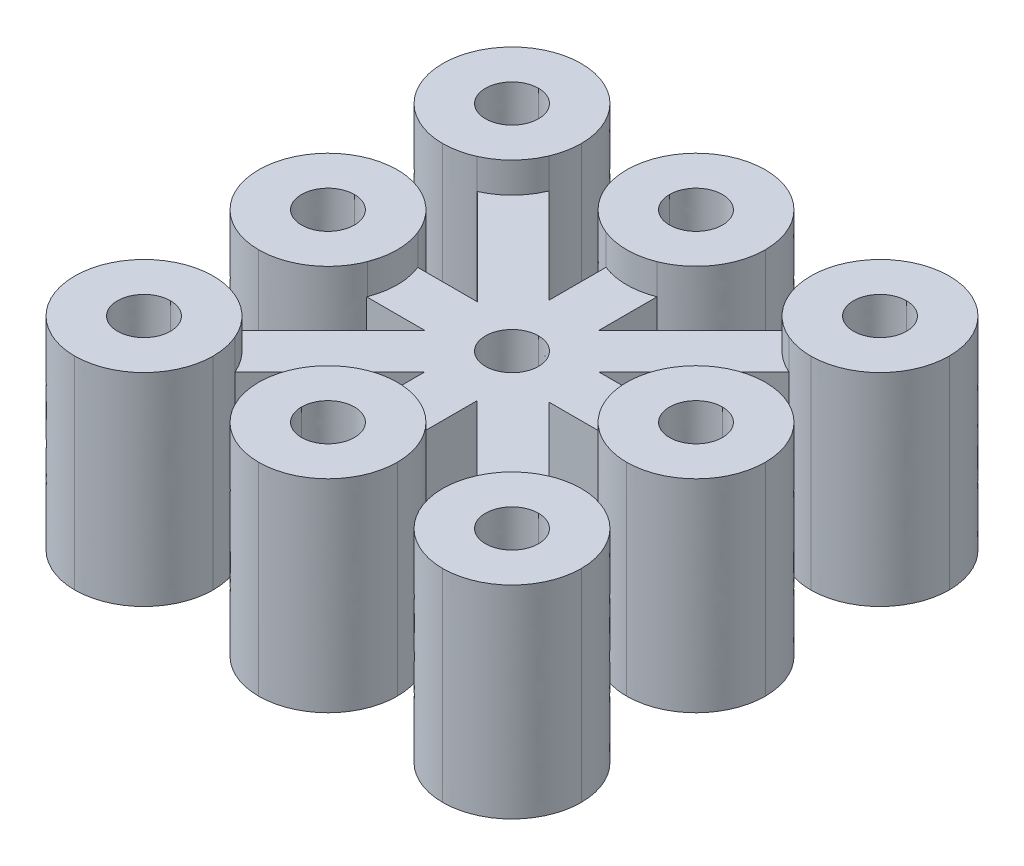
from build123d import *

# Parameters (mm, degrees)
BOSS_EXTRUDE1_DEPTH = 20
SKETCH3_R           = 2.569437734
CUT_EXTRUDE1_DEPTH  = 3


with BuildPart() as part:
    # Model → Boss-Extrude1 (new body)
    with BuildSketch(Plane(origin=(0, 0, 0), x_dir=(1, 0, 0), z_dir=(0, 1, 0))):
        with BuildLine():
            add(Edge.make_bspline(
                [(18.164089103, 31.837974264), (15.272931607, 31.837974264), (12.798637621, 30.041895219), (11.801043785, 27.503320376)],
                knots=[2, 2, 2, 2, 3, 3, 3, 3], degree=3))
            Line((11.801043785, 27.503320376), (6.045691815, 27.503320376))
            Line((6.045691815, 27.503320376), (15.43469708, 36.890249614))
            add(Edge.make_bspline(
                [(15.43469708, 36.890249614), (16.270525442, 36.52729949), (17.193445631, 36.324038813), (18.164089103, 36.324038813)],
                knots=[5, 5, 5, 5, 6, 6, 6, 6], degree=3))
            add(Edge.make_bspline(
                [(18.164089103, 36.324038813), (21.940836251, 36.324608674), (25.001601391, 39.386297611), (25.001031527, 43.163057418)],
                knots=[6, 6, 6, 6, 7, 7, 7, 7], degree=3))
            add(Edge.make_bspline(
                [(25.001031527, 43.163057418), (25.000461751, 46.939804567), (21.938772884, 50.000569776), (18.162025736, 50)],
                knots=[7, 7, 7, 7, 8, 8, 8, 8], degree=3))
            add(Edge.make_bspline(
                [(18.162025736, 50), (14.387341912, 50), (11.326114839, 46.938772927), (11.326114839, 43.162025736)],
                knots=[8, 8, 8, 8, 9, 9, 9, 9], degree=3))
            add(Edge.make_bspline(
                [(11.326114839, 43.162025736), (11.326114839, 42.193470949), (11.527286831, 41.272614127), (11.890236956, 40.438861791)],
                knots=[9, 9, 9, 9, 10, 10, 10, 10], degree=3))
            Line((11.890236956, 40.438861791), (2.515763874, 31.062300024))
            Line((2.515763874, 31.062300024), (2.515763874, 36.801069103))
            add(Edge.make_bspline(
                [(2.515763874, 36.801069103), (5.048110639, 37.802802331), (6.837974264, 40.272944266), (6.837974264, 43.162025736)],
                knots=[12, 12, 12, 12, 13, 13, 13, 13], degree=3))
            add(Edge.make_bspline(
                [(6.837974264, 43.162025736), (6.837974264, 46.938772927), (3.776747191, 50), (0, 50)],
                knots=[13, 13, 13, 13, 14, 14, 14, 14], degree=3))
            add(Edge.make_bspline(
                [(0, 50), (-3.774683824, 50), (-6.835910897, 46.938772927), (-6.835910897, 43.162025736)],
                knots=[14, 14, 14, 14, 15, 15, 15, 15], degree=3))
            add(Edge.make_bspline(
                [(-6.835910897, 43.162025736), (-6.835910897, 40.277083659), (-5.050199324, 37.80903041), (-2.521991952, 36.805208496)],
                knots=[15, 15, 15, 15, 16, 16, 16, 16], degree=3))
            Line((-2.521991952, 36.805208496), (-2.521991952, 31.155632588))
            Line((-2.521991952, 31.155632588), (-11.861210566, 40.499003254))
            add(Edge.make_bspline(
                [(-11.861210566, 40.499003254), (-11.514855992, 41.318236066), (-11.324051471, 42.218357944), (-11.324051471, 43.162025736)],
                knots=[18, 18, 18, 18, 19, 19, 19, 19], degree=3))
            add(Edge.make_bspline(
                [(-11.324051471, 43.162025736), (-11.324051471, 46.938772927), (-14.385278544, 50), (-18.15994971, 50)],
                knots=[19, 19, 19, 19, 20, 20, 20, 20], degree=3))
            add(Edge.make_bspline(
                [(-18.15994971, 50), (-21.936709559, 50), (-24.997936633, 46.938772927), (-24.997936633, 43.162025736)],
                knots=[20, 20, 20, 20, 21, 21, 21, 21], degree=3))
            add(Edge.make_bspline(
                [(-24.997936633, 43.162025736), (-24.997936633, 39.385265886), (-21.936709559, 36.324038813), (-18.15994971, 36.324038813)],
                knots=[21, 21, 21, 21, 22, 22, 22, 22], degree=3))
            add(Edge.make_bspline(
                [(-18.15994971, 36.324038813), (-17.160292507, 36.324038813), (-16.210396637, 36.539742988), (-15.353833332, 36.925504082)],
                knots=[22, 22, 22, 22, 23, 23, 23, 23], degree=3))
            Line((-15.353833332, 36.925504082), (-5.925421547, 27.503320376))
            Line((-5.925421547, 27.503320376), (-11.796917051, 27.503320376))
            add(Edge.make_bspline(
                [(-11.796917051, 27.503320376), (-12.794510886, 30.041895219), (-15.268792214, 31.837974264), (-18.15994971, 31.837974264)],
                knots=[25, 25, 25, 25, 26, 26, 26, 26], degree=3))
            add(Edge.make_bspline(
                [(-18.15994971, 31.837974264), (-21.936709559, 31.837974264), (-24.997936633, 28.77675985), (-24.997936633, 25)],
                knots=[26, 26, 26, 26, 27, 27, 27, 27], degree=3))
            add(Edge.make_bspline(
                [(-24.997936633, 25), (-24.997936633, 21.22324015), (-21.936709559, 18.162013077), (-18.15994971, 18.162013077)],
                knots=[27, 27, 27, 27, 28, 28, 28, 28], degree=3))
            add(Edge.make_bspline(
                [(-18.15994971, 18.162013077), (-15.254285348, 18.162013077), (-12.773775942, 19.974700331), (-11.782397527, 22.531934092)],
                knots=[28, 28, 28, 28, 29, 29, 29, 29], degree=3))
            add(Edge.make_bspline(
                [(-11.782397527, 22.531934092), (-11.790701631, 22.509123122), (-11.798993077, 22.488388178), (-11.807284522, 22.46556455)],
                knots=[29, 29, 29, 29, 30, 30, 30, 30], degree=3))
            Line((-11.807284522, 22.46556455), (-6.0809716, 22.46556455))
            Line((-6.0809716, 22.46556455), (-15.436785765, 13.111826412))
            add(Edge.make_bspline(
                [(-15.436785765, 13.111826412), (-16.270538101, 13.474776536), (-17.191394922, 13.675961187), (-18.15994971, 13.675961187)],
                knots=[32, 32, 32, 32, 33, 33, 33, 33], degree=3))
            add(Edge.make_bspline(
                [(-18.15994971, 13.675961187), (-21.936709559, 13.675961187), (-24.997936633, 10.614734114), (-24.997936633, 6.837974264)],
                knots=[33, 33, 33, 33, 34, 34, 34, 34], degree=3))
            add(Edge.make_bspline(
                [(-24.997936633, 6.837974264), (-24.997936633, 3.061214415), (-21.936709559, 0), (-18.15994971, 0)],
                knots=[34, 34, 34, 34, 35, 35, 35, 35], degree=3))
            add(Edge.make_bspline(
                [(-18.15994971, 0), (-14.385278544, 0), (-11.324051471, 3.061214415), (-11.324051471, 6.837974264)],
                knots=[35, 35, 35, 35, 36, 36, 36, 36], degree=3))
            add(Edge.make_bspline(
                [(-11.324051471, 6.837974264), (-11.324051471, 7.806529051), (-11.525223464, 8.729461899), (-11.890249614, 9.565290261)],
                knots=[36, 36, 36, 36, 37, 37, 37, 37], degree=3))
            Line((-11.890249614, 9.565290261), (-2.521991952, 18.937699976))
            Line((-2.521991952, 18.937699976), (-2.521991952, 13.194791504))
            add(Edge.make_bspline(
                [(-2.521991952, 13.194791504), (-5.050199324, 12.19096959), (-6.835910897, 9.722903682), (-6.835910897, 6.837974264)],
                knots=[39, 39, 39, 39, 40, 40, 40, 40], degree=3))
            add(Edge.make_bspline(
                [(-6.835910897, 6.837974264), (-6.835910897, 3.061214415), (-3.774683824, 0), (0, 0)],
                knots=[40, 40, 40, 40, 41, 41, 41, 41], degree=3))
            add(Edge.make_bspline(
                [(0, 0), (3.776747191, 0), (6.837974264, 3.061214415), (6.837974264, 6.837974264)],
                knots=[41, 41, 41, 41, 42, 42, 42, 42], degree=3))
            add(Edge.make_bspline(
                [(6.837974264, 6.837974264), (6.837974264, 9.727055734), (5.048110639, 12.197197669), (2.515763874, 13.198930897)],
                knots=[42, 42, 42, 42, 43, 43, 43, 43], degree=3))
            Line((2.515763874, 13.198930897), (2.515763874, 19.053843509))
            Line((2.515763874, 19.053843509), (11.925504082, 9.642027275))
            add(Edge.make_bspline(
                [(11.925504082, 9.642027275), (11.539730329, 8.785463969), (11.326114839, 7.837644126), (11.326114839, 6.837974264)],
                knots=[45, 45, 45, 45, 46, 46, 46, 46], degree=3))
            add(Edge.make_bspline(
                [(11.326114839, 6.837974264), (11.326114839, 3.061214415), (14.387341912, 0), (18.162025736, 0)],
                knots=[46, 46, 46, 46, 47, 47, 47, 47], degree=3))
            add(Edge.make_bspline(
                [(18.162025736, 0), (21.938772884, -0.000569776), (25.00046175, 3.060182775), (25.001031527, 6.836942582)],
                knots=[47, 47, 47, 47, 48, 48, 48, 48], degree=3))
            add(Edge.make_bspline(
                [(25.001031527, 6.836942582), (25.001601391, 10.613702389), (21.940836251, 13.675391326), (18.164089103, 13.675961187)],
                knots=[48, 48, 48, 48, 49, 49, 49, 49], degree=3))
            add(Edge.make_bspline(
                [(18.164089103, 13.675961187), (17.220408653, 13.675961187), (16.320299434, 13.485144008), (15.503142648, 13.138789434)],
                knots=[49, 49, 49, 49, 50, 50, 50, 50], degree=3))
            Line((15.503142648, 13.138789434), (6.178430899, 22.46556455))
            Line((6.178430899, 22.46556455), (11.811423916, 22.46556455))
            add(Edge.make_bspline(
                [(11.811423916, 22.46556455), (11.803119812, 22.488388178), (11.794828366, 22.509123122), (11.78653692, 22.531934092)],
                knots=[52, 52, 52, 52, 53, 53, 53, 53], degree=3))
            add(Edge.make_bspline(
                [(11.78653692, 22.531934092), (12.777902677, 19.974700331), (15.258412083, 18.162013077), (18.164089103, 18.162013077)],
                knots=[53, 53, 53, 53, 54, 54, 54, 54], degree=3))
            add(Edge.make_bspline(
                [(18.164089103, 18.162013077), (21.940836294, 18.162013077), (25.002063367, 21.22324015), (25.002063367, 25)],
                knots=[0, 0, 0, 0, 1, 1, 1, 1], degree=3))
            add(Edge.make_bspline(
                [(25.002063367, 25), (25.002063367, 28.77675985), (21.940836294, 31.837974264), (18.164089103, 31.837974264)],
                knots=[1, 1, 1, 1, 2, 2, 2, 2], degree=3))
        make_face()
        with BuildLine():
            add(Edge.make_bspline(
                [(-18.15994971, 4.224738433), (-19.601382735, 4.224738433), (-20.775274225, 5.396541239), (-20.775274225, 6.837974264), (-20.775274225, 8.279407289), (-19.601382735, 9.453286121), (-18.15994971, 9.453286121)],
                knots=[0, 0, 0, 0, 1, 1, 1, 2, 2, 2, 2], degree=3))
            add(Edge.make_bspline(
                [(-18.15994971, 9.453286121), (-16.718529343, 9.453286121), (-15.546713879, 8.279407289), (-15.546713879, 6.837974264), (-15.546713879, 5.396541239), (-16.718529343, 4.224738433), (-18.15994971, 4.224738433)],
                knots=[2, 2, 2, 2, 3, 3, 3, 4, 4, 4, 4], degree=3))
        make_face(mode=Mode.SUBTRACT)
        with BuildLine():
            add(Edge.make_bspline(
                [(0, 4.224738433), (-1.441433025, 4.224738433), (-2.61324849, 5.396541239), (-2.61324849, 6.837974264)],
                knots=[1, 1, 1, 1, 2, 2, 2, 2], degree=3))
            add(Edge.make_bspline(
                [(-2.61324849, 6.837974264), (-2.61324849, 8.279407289), (-1.441433025, 9.453286121), (0, 9.453286121)],
                knots=[2, 2, 2, 2, 3, 3, 3, 3], degree=3))
            add(Edge.make_bspline(
                [(0, 9.453286121), (1.443496393, 9.453286121), (2.615311857, 8.279407289), (2.615311857, 6.837974264)],
                knots=[3, 3, 3, 3, 4, 4, 4, 4], degree=3))
            add(Edge.make_bspline(
                [(2.615311857, 6.837974264), (2.615311857, 5.396541239), (1.443496393, 4.224738433), (0, 4.224738433)],
                knots=[0, 0, 0, 0, 1, 1, 1, 1], degree=3))
        make_face(mode=Mode.SUBTRACT)
        with BuildLine():
            add(Edge.make_bspline(
                [(-18.15994971, 22.384688143), (-19.601382735, 22.384688143), (-20.775274225, 23.558566975), (-20.775274225, 25), (-20.775274225, 26.441433025), (-19.601382735, 27.613235831), (-18.15994971, 27.613235831)],
                knots=[0, 0, 0, 0, 1, 1, 1, 2, 2, 2, 2], degree=3))
            add(Edge.make_bspline(
                [(-18.15994971, 27.613235831), (-16.718529343, 27.613235831), (-15.546713879, 26.441433025), (-15.546713879, 25), (-15.546713879, 23.558566975), (-16.718529343, 22.384688143), (-18.15994971, 22.384688143)],
                knots=[2, 2, 2, 2, 3, 3, 3, 4, 4, 4, 4], degree=3))
        make_face(mode=Mode.SUBTRACT)
        with BuildLine():
            add(Edge.make_bspline(
                [(0, 22.384688143), (-1.443509051, 22.384688143), (-2.61324849, 23.556490949), (-2.61324849, 25), (-2.61324849, 26.443509051), (-1.443509051, 27.615311857), (0, 27.615311857)],
                knots=[0, 0, 0, 0, 1, 1, 1, 2, 2, 2, 2], degree=3))
            add(Edge.make_bspline(
                [(0, 27.615311857), (1.445572419, 27.615311857), (2.615311857, 26.443509051), (2.615311857, 25), (2.615311857, 23.556490949), (1.445572419, 22.384688143), (0, 22.384688143)],
                knots=[2, 2, 2, 2, 3, 3, 3, 4, 4, 4, 4], degree=3))
        make_face(mode=Mode.SUBTRACT)
        with BuildLine():
            add(Edge.make_bspline(
                [(18.162025736, 9.453286121), (19.603446102, 9.453286121), (20.777337593, 8.279407289), (20.777337593, 6.837974264), (20.777337593, 5.396541239), (19.603446102, 4.224738433), (18.162025736, 4.224738433)],
                knots=[0, 0, 0, 0, 1, 1, 1, 2, 2, 2, 2], degree=3))
            add(Edge.make_bspline(
                [(18.162025736, 4.224738433), (16.720592711, 4.224738433), (15.548777246, 5.396541239), (15.548777246, 6.837974264), (15.548777246, 8.279407289), (16.720592711, 9.453286121), (18.162025736, 9.453286121)],
                knots=[2, 2, 2, 2, 3, 3, 3, 4, 4, 4, 4], degree=3))
        make_face(mode=Mode.SUBTRACT)
        with BuildLine():
            add(Edge.make_bspline(
                [(18.162025736, 27.613235831), (19.603446102, 27.613235831), (20.777337593, 26.441433025), (20.777337593, 25), (20.777337593, 23.558566975), (19.603446102, 22.384688143), (18.162025736, 22.384688143)],
                knots=[0, 0, 0, 0, 1, 1, 1, 2, 2, 2, 2], degree=3))
            add(Edge.make_bspline(
                [(18.162025736, 22.384688143), (16.720592711, 22.384688143), (15.548777246, 23.558566975), (15.548777246, 25), (15.548777246, 26.441433025), (16.720592711, 27.613235831), (18.162025736, 27.613235831)],
                knots=[2, 2, 2, 2, 3, 3, 3, 4, 4, 4, 4], degree=3))
        make_face(mode=Mode.SUBTRACT)
        with BuildLine():
            add(Edge.make_bspline(
                [(-18.15994971, 40.546713879), (-19.601382735, 40.546713879), (-20.775274225, 41.720592711), (-20.775274225, 43.162025736), (-20.775274225, 44.603458761), (-19.601382735, 45.775261567), (-18.15994971, 45.775261567)],
                knots=[0, 0, 0, 0, 1, 1, 1, 2, 2, 2, 2], degree=3))
            add(Edge.make_bspline(
                [(-18.15994971, 45.775261567), (-16.718529343, 45.775261567), (-15.546713879, 44.603458761), (-15.546713879, 43.162025736), (-15.546713879, 41.720592711), (-16.718529343, 40.546713879), (-18.15994971, 40.546713879)],
                knots=[2, 2, 2, 2, 3, 3, 3, 4, 4, 4, 4], degree=3))
        make_face(mode=Mode.SUBTRACT)
        with BuildLine():
            add(Edge.make_bspline(
                [(0, 45.775261567), (1.443496393, 45.775261567), (2.615311857, 44.603458761), (2.615311857, 43.162025736)],
                knots=[1, 1, 1, 1, 2, 2, 2, 2], degree=3))
            add(Edge.make_bspline(
                [(2.615311857, 43.162025736), (2.615311857, 41.720592711), (1.443496393, 40.546713879), (0, 40.546713879)],
                knots=[2, 2, 2, 2, 3, 3, 3, 3], degree=3))
            add(Edge.make_bspline(
                [(0, 40.546713879), (-1.441433025, 40.546713879), (-2.61324849, 41.720592711), (-2.61324849, 43.162025736)],
                knots=[3, 3, 3, 3, 4, 4, 4, 4], degree=3))
            add(Edge.make_bspline(
                [(-2.61324849, 43.162025736), (-2.61324849, 44.603458761), (-1.441433025, 45.775261567), (0, 45.775261567)],
                knots=[0, 0, 0, 0, 1, 1, 1, 1], degree=3))
        make_face(mode=Mode.SUBTRACT)
        with BuildLine():
            add(Edge.make_bspline(
                [(18.162025736, 45.775261567), (19.603446102, 45.775261567), (20.777337593, 44.603458761), (20.777337593, 43.162025736), (20.777337593, 41.720592711), (19.603446102, 40.546713879), (18.162025736, 40.546713879)],
                knots=[0, 0, 0, 0, 1, 1, 1, 2, 2, 2, 2], degree=3))
            add(Edge.make_bspline(
                [(18.162025736, 40.546713879), (16.720592711, 40.546713879), (15.548777246, 41.720592711), (15.548777246, 43.162025736), (15.548777246, 44.603458761), (16.720592711, 45.775261567), (18.162025736, 45.775261567)],
                knots=[2, 2, 2, 2, 3, 3, 3, 4, 4, 4, 4], degree=3))
        make_face(mode=Mode.SUBTRACT)
    extrude(amount=BOSS_EXTRUDE1_DEPTH)

    # Sketch3 → Cut-Extrude1 (cut)
    with BuildSketch(Plane(origin=(0, 20, 0), x_dir=(1, 0, 0), z_dir=(0, 1, 0))):
        with BuildLine():
            ThreePointArc((15.43469708, 36.890249614), (13.325033971, 38.327356718), (11.889393525, 40.438018172))
            Line((11.889393525, 40.438018172), (2.515763874, 31.062300024))
            Line((2.515763874, 31.062300024), (2.515763874, 36.801069103))
            ThreePointArc((2.515763874, 36.801069103), (-0.003427406, 36.322023734), (-2.521991952, 36.804353284))
            Line((-2.521991952, 36.804353284), (-2.521991952, 31.155632588))
            Line((-2.521991952, 31.155632588), (-11.861210566, 40.499003254))
            ThreePointArc((-11.861210566, 40.499003254), (-13.269271697, 38.38170486), (-15.35357161, 36.925242533))
            Line((-15.35357161, 36.925242533), (-5.925421547, 27.503320376))
            Line((-5.925421547, 27.503320376), (-11.796917051, 27.503320376))
            ThreePointArc((-11.796917051, 27.503320376), (-11.321838224, 24.983899975), (-11.808011224, 22.466596881))
            Line((-11.808011224, 22.466596881), (-11.807284522, 22.46556455))
            Line((-11.807284522, 22.46556455), (-6.0809716, 22.46556455))
            Line((-6.0809716, 22.46556455), (-15.436785765, 13.111826412))
            ThreePointArc((-15.436785765, 13.111826412), (-13.32613935, 11.676170166), (-11.889022281, 9.566518139))
            Line((-11.889022281, 9.566518139), (-2.521991952, 18.937699976))
            Line((-2.521991952, 18.937699976), (-2.521991952, 13.196463757))
            ThreePointArc((-2.521991952, 13.196463757), (-0.003349468, 13.678429029), (2.515763874, 13.198930897))
            Line((2.515763874, 13.198930897), (2.515763874, 19.053843509))
            Line((2.515763874, 19.053843509), (11.925185731, 9.642345696))
            ThreePointArc((11.925185731, 9.642345696), (13.38293042, 11.729523443), (15.503142648, 13.138789434))
            Line((15.503142648, 13.138789434), (6.178430899, 22.46556455))
            Line((6.178430899, 22.46556455), (11.811423916, 22.46556455))
            Line((11.811423916, 22.46556455), (11.811413772, 22.470487802))
            ThreePointArc((11.811413772, 22.470487802), (11.326200556, 24.985915007), (11.801043785, 27.503320376))
            Line((11.801043785, 27.503320376), (6.045691815, 27.503320376))
            Line((6.045691815, 27.503320376), (15.43469708, 36.890249614))
        make_face()
        with Locations((0, 25)):
            Circle(SKETCH3_R, mode=Mode.SUBTRACT)
    cut_extrude1 = extrude(amount=-CUT_EXTRUDE1_DEPTH, mode=Mode.SUBTRACT)

    # Mirror2: Cut-Extrude1 across plane
    add(cut_extrude1.mirror(Plane.ZX.offset(10)), mode=Mode.SUBTRACT)


solid = part.part
